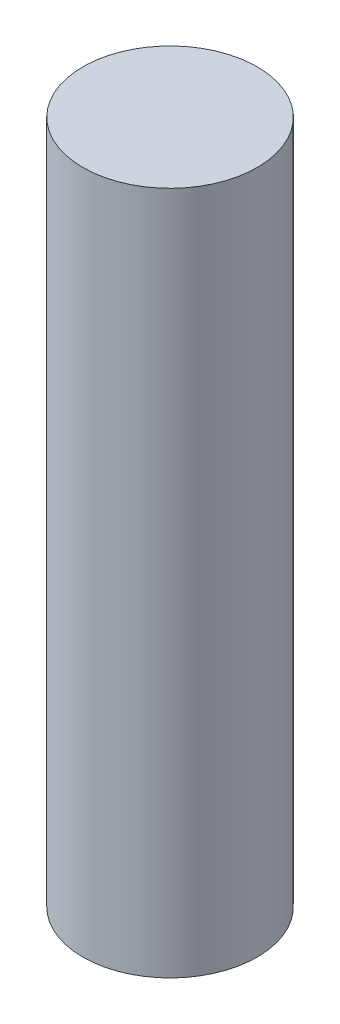
from build123d import *

# Parameters (mm, degrees)
SKETCH1_R           = 12.75
BOSS_EXTRUDE1_DEPTH = 100


with BuildPart() as part:
    # Sketch1 → Boss-Extrude1 (new body)
    with BuildSketch(Plane(origin=(0, 0, 0), x_dir=(1, 0, 0), z_dir=(0, 1, 0))):
        with Locations(Location((0, 0, 0), (0, 0, 270))):
            Circle(SKETCH1_R)
    extrude(amount=BOSS_EXTRUDE1_DEPTH)


solid = part.part
